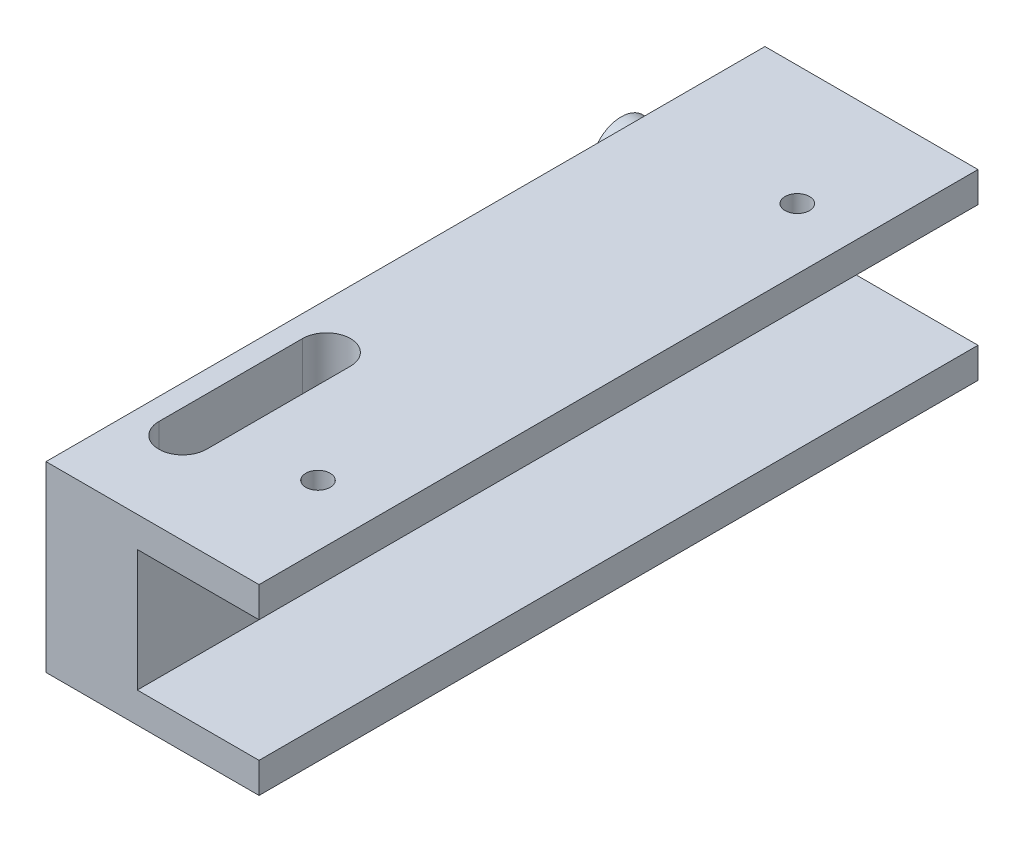
from build123d import *

# Parameters (mm, degrees)
SALIENTE_EXTRUIR1_DEPTH       = 75
CROQUIS2_R                    = 6.35
SALIENTE_EXTRUIR2_DEPTH       = 15
CORTAR_EXTRUIR1_DEPTH         = 85.541735255
CORTAR_EXTRUIR1_DEPTH_BACK    = 85.541735255
CORTAR_EXTRUIR2_DEPTH         = 85.541735255
CORTAR_EXTRUIR2_DEPTH_BACK    = 85.541735255
TALADRO_ROSCADO_1_4_201_D     = 5.1054
TALADRO_ROSCADO_1_4_201_DEPTH = 6.35


with BuildPart() as part:
    # Croquis1 → Saliente-Extruir1 (new, symmetric)
    with BuildSketch(Plane.XY):
        Polygon((0, 12.7), (0, -12.7), (25.4, -12.7), (25.4, -19.05), (-19.05, -19.05), (-19.05, 19.05), (25.4, 19.05), (25.4, 12.7), align=None)
    extrude(amount=SALIENTE_EXTRUIR1_DEPTH, both=True)

    # Croquis2 → Saliente-Extruir2 (add)
    with BuildSketch(Plane.ZY.offset(19.05)):
        with Locations(Location((-60, 0, 0), (0, 0, 180))):
            Circle(CROQUIS2_R)
    extrude(amount=SALIENTE_EXTRUIR2_DEPTH)

    # Croquis3 → Cortar-Extruir1 (cut, two sides: drawn at the far end of the back side and taken through both)
    with BuildSketch(Plane(origin=(0, 0, 0), x_dir=(1, 0, 0), z_dir=(0, 1, 0)).offset(-CORTAR_EXTRUIR1_DEPTH_BACK)):
        with BuildLine():
            Line((-4.525, -26), (-4.525, -56))
            ThreePointArc((-4.525, -56), (-9.525, -61), (-14.525, -56))
            Line((-14.525, -56), (-14.525, -26))
            ThreePointArc((-14.525, -26), (-9.525, -21), (-4.525, -26))
        make_face()
    extrude(amount=CORTAR_EXTRUIR1_DEPTH + CORTAR_EXTRUIR1_DEPTH_BACK, mode=Mode.SUBTRACT)

    # Croquis4 → Cortar-Extruir2 (cut, two sides: drawn at the far end of the back side and taken through both)
    with BuildSketch(Plane(origin=(0, 0, 0), x_dir=(0, 0, -1), z_dir=(1, 0, 0)).offset(-CORTAR_EXTRUIR2_DEPTH_BACK)):
        with BuildLine():
            ThreePointArc((-18.2012838, 6.841725806), (-18.5, 0), (-18.2012838, -6.841725806))
            ThreePointArc((-18.2012838, -6.841725806), (-14.409557257, -10.023362149), (-11.227920914, -6.231635606))
            ThreePointArc((-11.227920914, -6.231635606), (-11.5, 0), (-11.227920914, 6.231635606))
            ThreePointArc((-11.227920914, 6.231635606), (-14.409557257, 10.023362149), (-18.2012838, 6.841725806))
        make_face()
    extrude(amount=CORTAR_EXTRUIR2_DEPTH + CORTAR_EXTRUIR2_DEPTH_BACK, mode=Mode.SUBTRACT)

    # Taladro roscado 1/4-201
    with Locations(Plane(origin=(0, 19.05, 0), x_dir=(1, 0, 0), z_dir=(0, 1, 0))):
        with Locations((12.7, -50), (12.7, 50)):
            Hole(TALADRO_ROSCADO_1_4_201_D / 2, depth=TALADRO_ROSCADO_1_4_201_DEPTH)


solid = part.part
